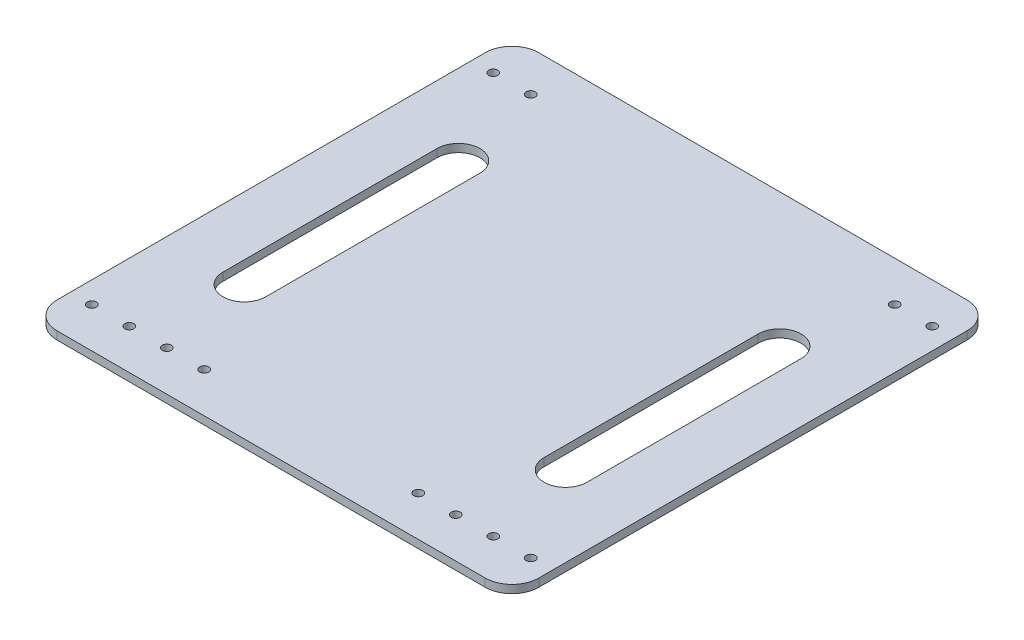
from build123d import *

# Parameters (mm, degrees)
SKETCH1_W           = 180
SKETCH1_H           = 180
BOSS_EXTRUDE1_DEPTH = 3
FILLET1_R           = 10
SKETCH2_R           = 1.7
CUT_EXTRUDE1_DEPTH  = 3
CUT_EXTRUDE2_DEPTH  = 128.314571044


with BuildPart() as part:
    # Sketch1 → Boss-Extrude1 (new body)
    with BuildSketch(Plane(origin=(0, 0, 0), x_dir=(1, 0, 0), z_dir=(0, 1, 0))):
        Rectangle(SKETCH1_W, SKETCH1_H)
    extrude(amount=BOSS_EXTRUDE1_DEPTH)

    # Fillet1
    fillet1_edges = [part.edges().sort_by_distance(p)[0] for p in [
        (90, 1.5, 90),
        (-90, 1.5, 90),
        (-90, 1.5, -90),
        (90, 1.5, -90),
    ]]
    fillet(fillet1_edges, radius=FILLET1_R)

    # Sketch2 → Cut-Extrude1 (cut)
    with BuildSketch(Plane(origin=(0, 3, 0), x_dir=(1, 0, 0), z_dir=(0, 1, 0))):
        with Locations(Location((-82, 75, 0), (0, 0, 270))):
            Circle(SKETCH2_R)
        with Locations(Location((-68, 75, 0), (0, 0, 270))):
            Circle(SKETCH2_R)
        with Locations(Location((68, 75, 0), (0, 0, 270))):
            Circle(SKETCH2_R)
        with Locations(Location((82, 75, 0), (0, 0, 270))):
            Circle(SKETCH2_R)
        with Locations(Location((-82, -75, 0), (0, 0, 270))):
            Circle(SKETCH2_R)
        with Locations(Location((-68, -75, 0), (0, 0, 270))):
            Circle(SKETCH2_R)
        with Locations(Location((68, -75, 0), (0, 0, 270))):
            Circle(SKETCH2_R)
        with Locations(Location((82, -75, 0), (0, 0, 270))):
            Circle(SKETCH2_R)
        with Locations(Location((-54, -75, 0), (0, 0, 270))):
            Circle(SKETCH2_R)
        with Locations(Location((54, -75, 0), (0, 0, 270))):
            Circle(SKETCH2_R)
        with Locations(Location((-40, -75, 0), (0, 0, 270))):
            Circle(SKETCH2_R)
        with Locations(Location((40, -75, 0), (0, 0, 270))):
            Circle(SKETCH2_R)
    extrude(amount=-CUT_EXTRUDE1_DEPTH, mode=Mode.SUBTRACT)

    # Sketch3 → Cut-Extrude2 (cut, through all)
    with BuildSketch(Plane(origin=(0, 3, 0), x_dir=(1, 0, 0), z_dir=(0, 1, 0))):
        with BuildLine():
            Line((-52, 40), (-52, -40))
            ThreePointArc((-52, -40), (-60, -48), (-68, -40))
            Line((-68, -40), (-68, 40))
            ThreePointArc((-68, 40), (-60, 48), (-52, 40))
        make_face()
        with BuildLine():
            Line((68, 40), (68, -40))
            ThreePointArc((68, -40), (60, -48), (52, -40))
            Line((52, -40), (52, 40))
            ThreePointArc((52, 40), (60, 48), (68, 40))
        make_face()
    extrude(amount=-CUT_EXTRUDE2_DEPTH, mode=Mode.SUBTRACT)


solid = part.part
